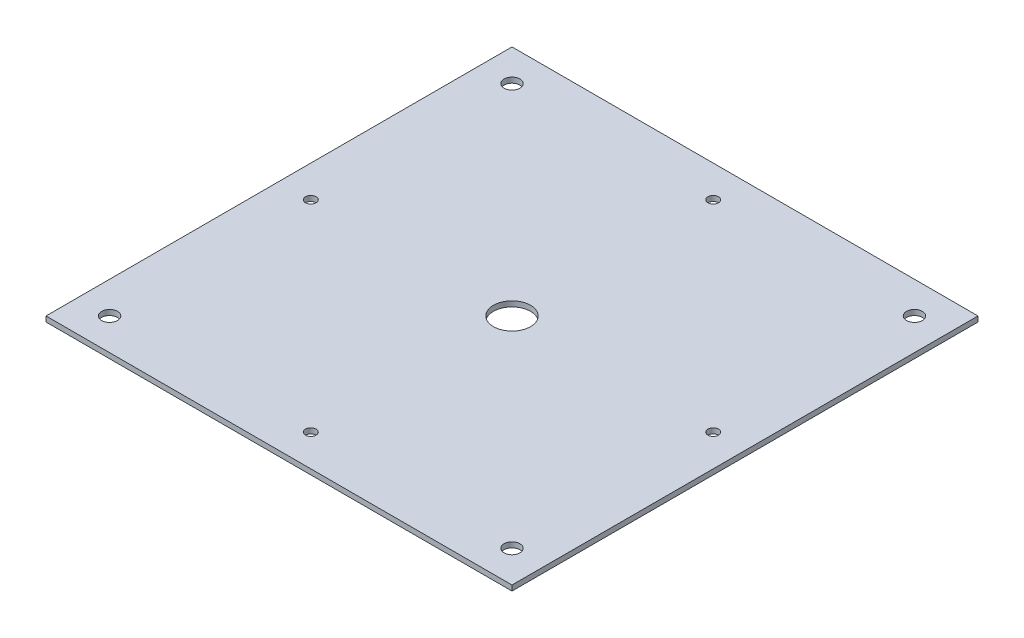
from build123d import *

# Parameters (mm, degrees)
SKETCH1_W           = 279.4
SKETCH1_H           = 279.4
SKETCH1_R           = 11.1125
BOSS_EXTRUDE1_DEPTH = 3.175
SKETCH2_R           = 3.175
SKETCH2_R_2         = 4.7625
CUT_EXTRUDE1_DEPTH  = 198.591145108


with BuildPart() as part:
    # Sketch1 → Boss-Extrude1 (new body)
    with BuildSketch(Plane(origin=(0, 0, 0), x_dir=(1, 0, 0), z_dir=(0, 1, 0))):
        Rectangle(SKETCH1_W, SKETCH1_H)
        with Locations(Location((0, 0, 0), (0, 0, 270))):
            Circle(SKETCH1_R, mode=Mode.SUBTRACT)
    extrude(amount=BOSS_EXTRUDE1_DEPTH)

    # Sketch2 → Cut-Extrude1 (cut, through all)
    with BuildSketch(Plane(origin=(0, 3.175, 0), x_dir=(1, 0, 0), z_dir=(0, 1, 0))):
        with Locations(Location((0, 120.65, 0), (0, 0, 270))):
            Circle(SKETCH2_R)
        with Locations(Location((120.65, 0, 0), (0, 0, 270))):
            Circle(SKETCH2_R)
        with Locations(Location((0, -120.65, 0), (0, 0, 270))):
            Circle(SKETCH2_R)
        with Locations(Location((-120.65, 0, 0), (0, 0, 270))):
            Circle(SKETCH2_R)
        with Locations(Location((-120.65, 120.65, 0), (0, 0, 270))):
            Circle(SKETCH2_R_2)
        with Locations(Location((120.65, 120.65, 0), (0, 0, 90))):
            Circle(SKETCH2_R_2)
        with Locations(Location((-120.65, -120.65, 0), (0, 0, 90))):
            Circle(SKETCH2_R_2)
        with Locations(Location((120.65, -120.65, 0), (0, 0, 270))):
            Circle(SKETCH2_R_2)
    extrude(amount=-CUT_EXTRUDE1_DEPTH, mode=Mode.SUBTRACT)


solid = part.part
